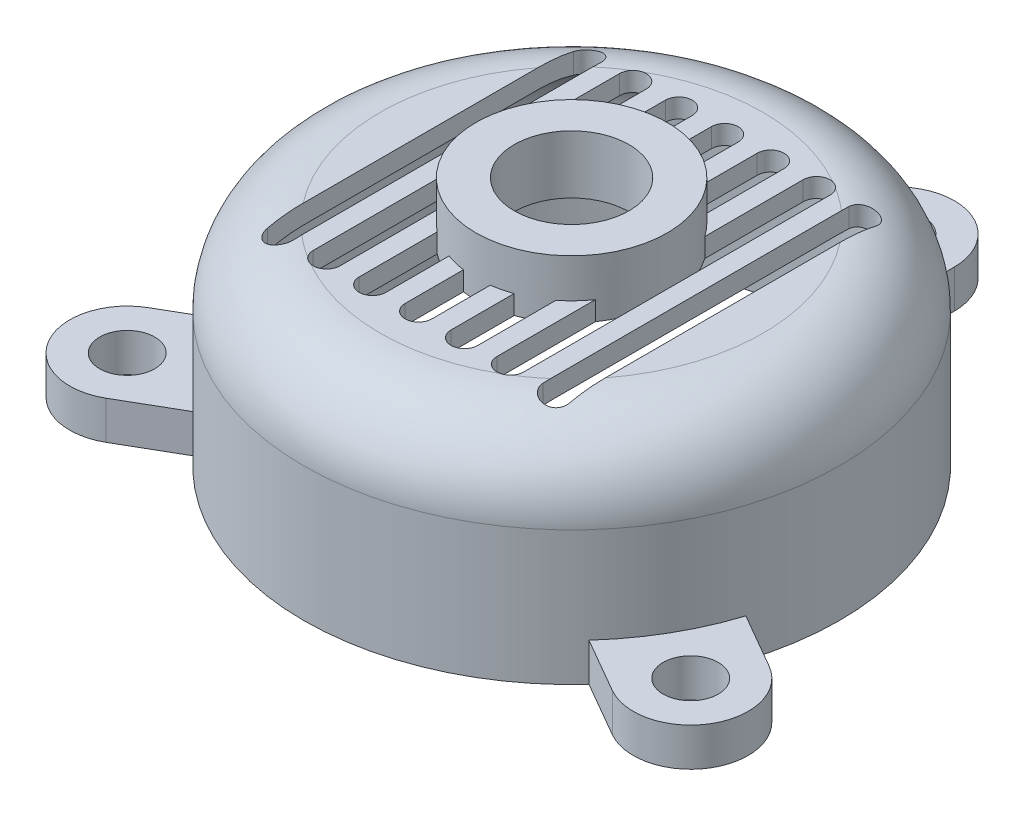
from build123d import *

# Parameters (mm, degrees)
SKETCH1_R                = 87.5
BOSS_EXTRUDE1_DEPTH      = 68.75
FILLET1_R                = 25
SHELL1_T                 = -6.25
CUT_EXTRUDE1_DEPTH       = 68.75
BOSS_EXTRUDE2_DEPTH      = 12.75
BOSS_EXTRUDE2_DEPTH_BACK = 6.25
SKETCH3_R                = 31.25
SKETCH3_R_2              = 18.75
CUT_EXTRUDE2_START       = -12.75
SKETCH4_R                = 18.75
CUT_EXTRUDE2_DEPTH       = 12.75
SKETCH5_R                = 9
BOSS_EXTRUDE3_DEPTH      = 12.5


with BuildPart() as part:
    # Sketch1 → Boss-Extrude1 (new body)
    with BuildSketch(Plane(origin=(0, 0, 0), x_dir=(1, 0, 0), z_dir=(0, 1, 0))):
        with Locations(Location((0, 0, 0), (0, 0, 270))):
            Circle(SKETCH1_R)
    extrude(amount=BOSS_EXTRUDE1_DEPTH)

    # Fillet1
    fillet1_edges = [part.edges().sort_by_distance(p)[0] for p in [
        (0, 68.75, -87.5),
    ]]
    fillet(fillet1_edges, radius=FILLET1_R)

    # Shell1
    shell1_openings = [part.faces().sort_by_distance(p)[0] for p in [
        (0, 0, 0),
    ]]
    offset(amount=SHELL1_T, openings=shell1_openings, kind=Kind.INTERSECTION)

    # Sketch2 → Cut-Extrude1 (cut)
    with BuildSketch(Plane(origin=(0, 68.75, 0), x_dir=(1, 0, 0), z_dir=(0, 1, 0))):
        with BuildLine():
            Line((-34.375, -50), (-34.375, 50))
            ThreePointArc((-34.375, 50), (-30, 54.375), (-25.625, 50))
            Line((-25.625, 50), (-25.625, -50))
            ThreePointArc((-25.625, -50), (-30, -54.375), (-34.375, -50))
        make_face()
        with BuildLine():
            Line((-49.375, -50), (-49.375, 50))
            ThreePointArc((-49.375, 50), (-45, 54.375), (-40.625, 50))
            Line((-40.625, 50), (-40.625, -50))
            ThreePointArc((-40.625, -50), (-45, -54.375), (-49.375, -50))
        make_face()
        with BuildLine():
            Line((-19.375, -50), (-19.375, 50))
            ThreePointArc((-19.375, 50), (-15, 54.375), (-10.625, 50))
            Line((-10.625, 50), (-10.625, -50))
            ThreePointArc((-10.625, -50), (-15, -54.375), (-19.375, -50))
        make_face()
        with BuildLine():
            Line((-4.375, -50), (-4.375, 50))
            ThreePointArc((-4.375, 50), (0, 54.375), (4.375, 50))
            Line((4.375, 50), (4.375, -50))
            ThreePointArc((4.375, -50), (0, -54.375), (-4.375, -50))
        make_face()
        with BuildLine():
            Line((10.625, -50), (10.625, 50))
            ThreePointArc((10.625, 50), (15, 54.375), (19.375, 50))
            Line((19.375, 50), (19.375, -50))
            ThreePointArc((19.375, -50), (15, -54.375), (10.625, -50))
        make_face()
        with BuildLine():
            Line((25.625, -50), (25.625, 50))
            ThreePointArc((25.625, 50), (30, 54.375), (34.375, 50))
            Line((34.375, 50), (34.375, -50))
            ThreePointArc((34.375, -50), (30, -54.375), (25.625, -50))
        make_face()
        with BuildLine():
            Line((40.625, -50), (40.625, 50))
            ThreePointArc((40.625, 50), (45, 54.375), (49.375, 50))
            Line((49.375, 50), (49.375, -50))
            ThreePointArc((49.375, -50), (45, -54.375), (40.625, -50))
        make_face()
    extrude(amount=-CUT_EXTRUDE1_DEPTH, mode=Mode.SUBTRACT)

    # Sketch3 → Boss-Extrude2 (add, two sides: drawn at the far end of the back side and taken through both)
    with BuildSketch(Plane(origin=(0, 68.75, 0), x_dir=(1, 0, 0), z_dir=(0, 1, 0)).offset(-BOSS_EXTRUDE2_DEPTH_BACK)):
        with Locations(Location((0, 0, 0), (0, 0, 270))):
            Circle(SKETCH3_R)
        with Locations(Location((0, 0, 0), (0, 0, 270))):
            Circle(SKETCH3_R_2, mode=Mode.SUBTRACT)
    extrude(amount=BOSS_EXTRUDE2_DEPTH + BOSS_EXTRUDE2_DEPTH_BACK)

    # Sketch4 → Cut-Extrude2 (cut)
    with BuildSketch(Plane.XZ.offset(-62.5).offset(CUT_EXTRUDE2_START)):
        with Locations(Location((0, 0, 0), (0, 0, 90))):
            Circle(SKETCH4_R)
    extrude(amount=CUT_EXTRUDE2_DEPTH, mode=Mode.SUBTRACT)

    # Sketch5 → Boss-Extrude3 (add)
    # profile 1 of 3: a face of its own
    with BuildSketch(Plane(origin=(0, 0, 0), x_dir=(1, 0, 0), z_dir=(0, 1, 0))):
        with BuildLine():
            Line((-18.75, 106.25), (-18.75, 85.46746457))
            ThreePointArc((-18.75, 85.46746457), (0, 87.5), (18.75, 85.46746457))
            Line((18.75, 85.46746457), (18.75, 106.25))
            ThreePointArc((18.75, 106.25), (0, 125), (-18.75, 106.25))
        make_face()
        with Locations(Location((0, 106.25, 0), (0, 0, 270))):
            Circle(SKETCH5_R, mode=Mode.SUBTRACT)
    # profile 2 of 3: a face of its own
    with BuildSketch(Plane(origin=(0, 0, 0), x_dir=(1, 0, 0), z_dir=(0, 1, 0))):
        with BuildLine():
            Line((101.390199152, -36.887023679), (83.391995515, -26.495755964))
            ThreePointArc((83.391995515, -26.495755964), (75.777222831, -43.75), (64.641995515, -58.971708606))
            Line((64.641995515, -58.971708606), (82.640199152, -69.362976321))
            ThreePointArc((82.640199152, -69.362976321), (108.253175473, -62.5), (101.390199152, -36.887023679))
        make_face()
        with Locations(Location((92.015199152, -53.125, 0), (0, 0, 270))):
            Circle(SKETCH5_R, mode=Mode.SUBTRACT)
    # profile 3 of 3: a face of its own
    with BuildSketch(Plane(origin=(0, 0, 0), x_dir=(1, 0, 0), z_dir=(0, 1, 0))):
        with BuildLine():
            Line((-82.640199152, -69.362976321), (-64.641995515, -58.971708606))
            ThreePointArc((-64.641995515, -58.971708606), (-75.777222831, -43.75), (-83.391995515, -26.495755964))
            Line((-83.391995515, -26.495755964), (-101.390199152, -36.887023679))
            ThreePointArc((-101.390199152, -36.887023679), (-108.253175473, -62.5), (-82.640199152, -69.362976321))
        make_face()
        with Locations(Location((-92.015199152, -53.125, 0), (0, 0, 270))):
            Circle(SKETCH5_R, mode=Mode.SUBTRACT)
    extrude(amount=BOSS_EXTRUDE3_DEPTH)


solid = part.part
